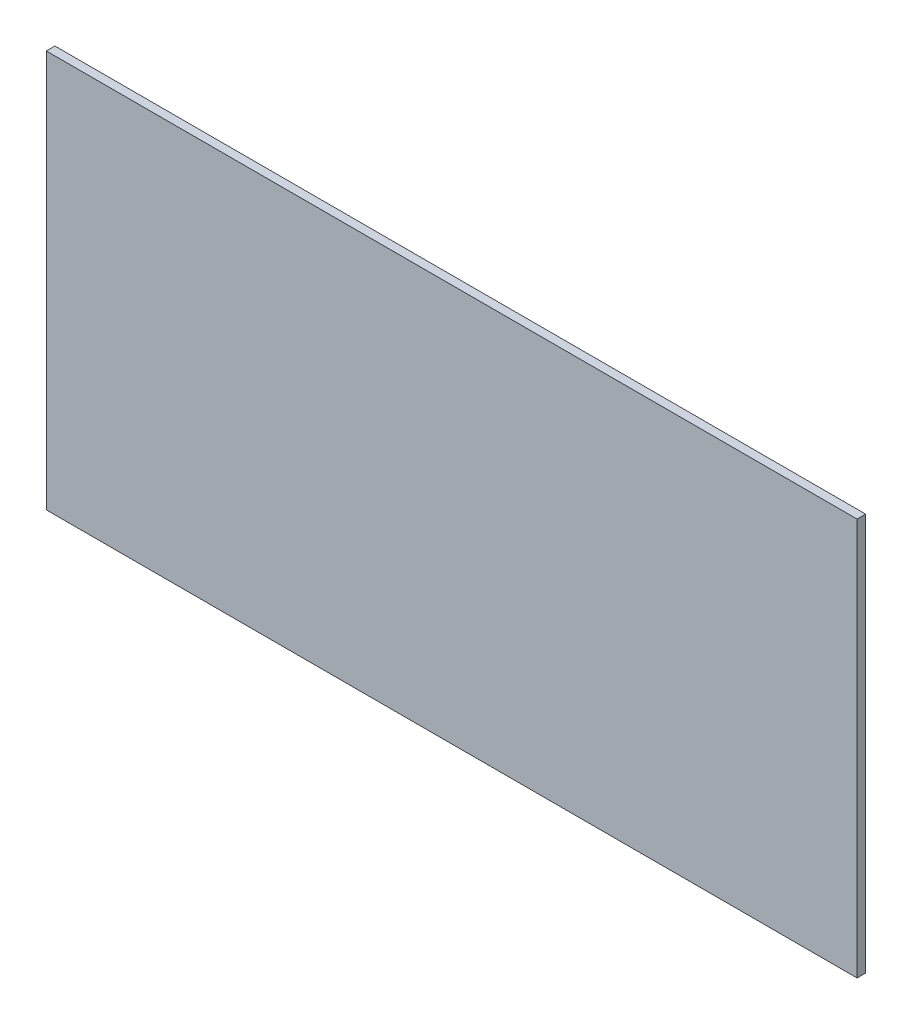
from build123d import *

# Parameters (mm, degrees)
SKETCH2_W           = 102
SKETCH2_H           = 50
BOSS_EXTRUDE1_DEPTH = 1.08


with BuildPart() as part:
    # Sketch2 → Boss-Extrude1 (new body)
    with BuildSketch(Plane.XY):
        Rectangle(SKETCH2_W, SKETCH2_H)
    extrude(amount=BOSS_EXTRUDE1_DEPTH)


solid = part.part
